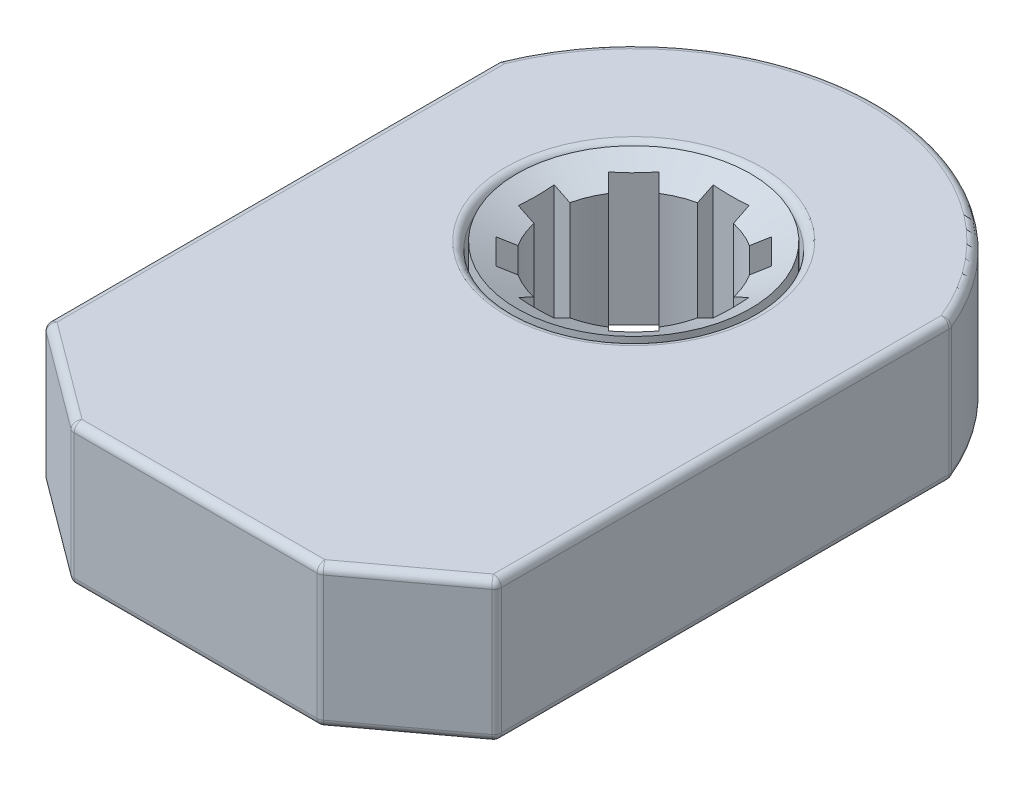
from build123d import *

# Parameters (mm, degrees)
SKETCH1_R           = 7.65
BOSS_EXTRUDE1_DEPTH = 9
CUT_EXTRUDE1_DEPTH  = 9
SKETCH7_W           = 2.28233216
SKETCH7_H           = 6.201106096
CUT_EXTRUDE2_DEPTH  = 33.637748467
CIRPATTERN1_COUNT   = 8
FILLET1_R           = 0.5


with BuildPart() as part:
    # Sketch1 → Boss-Extrude1 (new body)
    with BuildSketch(Plane(origin=(0, 0, 0), x_dir=(1, 0, 0), z_dir=(0, 1, 0))):
        with BuildLine():
            Line((-14.385, 5.772501624), (-14.385, -27.88))
            Line((-14.385, -27.88), (14.385, -27.88))
            Line((14.385, -27.88), (14.385, 5.772501624))
            ThreePointArc((14.385, 5.772501624), (0, 15.5), (-14.385, 5.772501624))
        make_face()
        Circle(SKETCH1_R, mode=Mode.SUBTRACT)
    extrude(amount=BOSS_EXTRUDE1_DEPTH)

    # Sketch3 → Cut-Extrude1 (cut)
    with BuildSketch(Plane(origin=(0, 9, 0), x_dir=(1, 0, 0), z_dir=(0, 1, 0))):
        Polygon((14.385, -23.064188118), (7.893798328, -27.88), (14.385, -27.88), align=None)
        Polygon((-14.385, -27.88), (-14.385, -23.064188118), (-7.893798328, -27.88), align=None)
    extrude(amount=-CUT_EXTRUDE1_DEPTH, mode=Mode.SUBTRACT)

    # Fillet1
    fillet1_edges = [part.edges().sort_by_distance(p)[0] for p in [
        (0, 9, -15.5),
        (0, 0, -15.5),
        (14.385, 4.5, -5.772501624),
        (14.385, 0, 8.645843247),
        (14.385, 9, 8.645843247),
        (14.385, 4.5, 23.064188118),
        (11.139399164, 0, 25.472094059),
        (11.139399164, 9, 25.472094059),
        (7.893798328, 4.5, 27.88),
        (0, 0, 27.88),
        (0, 9, 27.88),
        (-14.385, 4.5, -5.772501624),
        (-14.385, 9, 8.645843247),
        (-14.385, 0, 8.645843247),
        (-7.893798328, 4.5, 27.88),
        (-11.139399164, 0, 25.472094059),
        (-14.385, 4.5, 23.064188118),
        (-11.139399164, 9, 25.472094059),
        (-7.65, 9, 0),
    ]]
    fillet(fillet1_edges, radius=FILLET1_R)


with BuildPart() as body_2:
    # Sketch6 → Revolve1 (revolve)
    with BuildSketch(Plane(origin=(0, 0, 0), x_dir=(0, 0, -1), z_dir=(1, 0, 0))):
        Polygon((-7.435802811, 9), (-7.435802811, 0), (-5.330679473, 0), (-5.330679473, 7.943849085), align=None)
    revolve(axis=Axis((0, 0, 0), (0, 1, 0)))

    # Sketch7 → Cut-Extrude2 (cut, symmetric)
    with BuildSketch(Plane(origin=(0, 0, 0), x_dir=(1, 0, 0), z_dir=(0, 1, 0))):
        with Locations((0, 3.100553048)):
            Rectangle(SKETCH7_W, SKETCH7_H)
    cut_extrude2 = extrude(amount=CUT_EXTRUDE2_DEPTH, both=True, mode=Mode.SUBTRACT)

    # CirPattern1: Cut-Extrude2 ×8 about axis
    cirpattern1_axis = Axis((0, 9.45, 0), (0, -1, 0))
    for i in range(1, CIRPATTERN1_COUNT):
        add(cut_extrude2.rotate(cirpattern1_axis, i * 360 / CIRPATTERN1_COUNT), mode=Mode.SUBTRACT)


solid = Compound([part.part, body_2.part])
